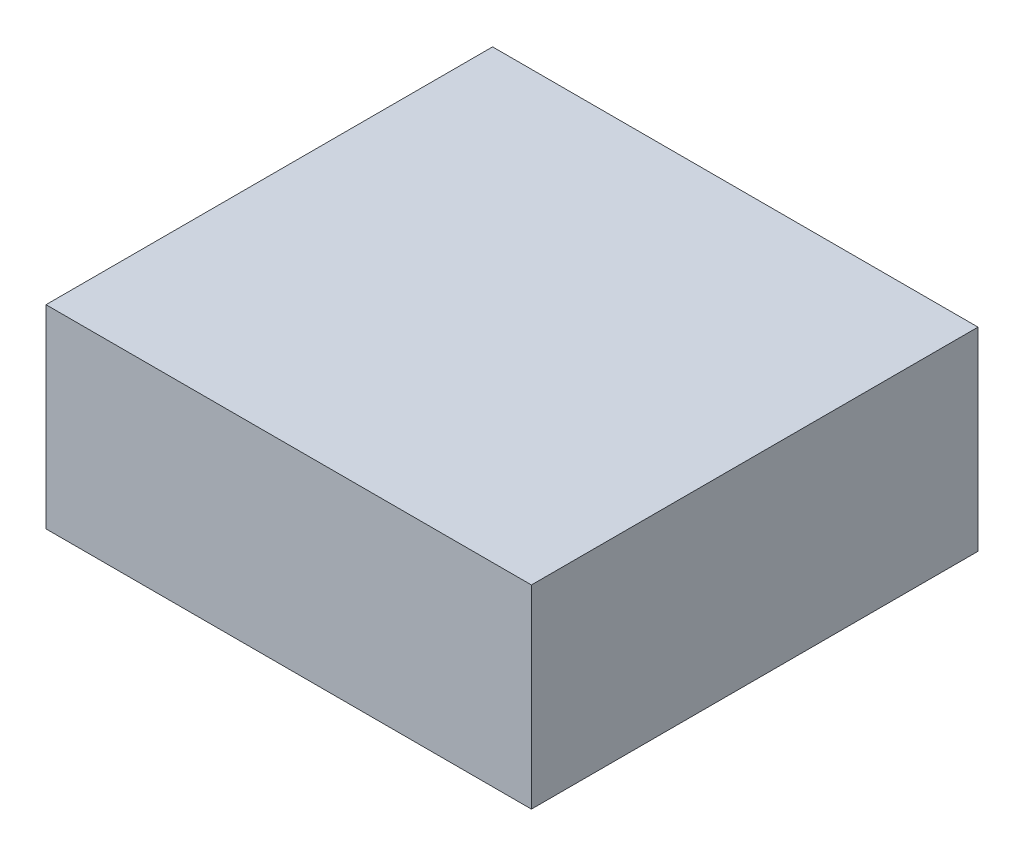
from build123d import *

# Parameters (mm, degrees)
SKETCH1_W           = 2.5
SKETCH1_H           = 2.3
BOSS_EXTRUDE1_DEPTH = 1


with BuildPart() as part:
    # Sketch1 → Boss-Extrude1 (new body)
    with BuildSketch(Plane(origin=(0, 0, 0), x_dir=(1, 0, 0), z_dir=(0, 1, 0))):
        with Locations((1.25, -1.15)):
            Rectangle(SKETCH1_W, SKETCH1_H)
    extrude(amount=BOSS_EXTRUDE1_DEPTH)


solid = part.part
